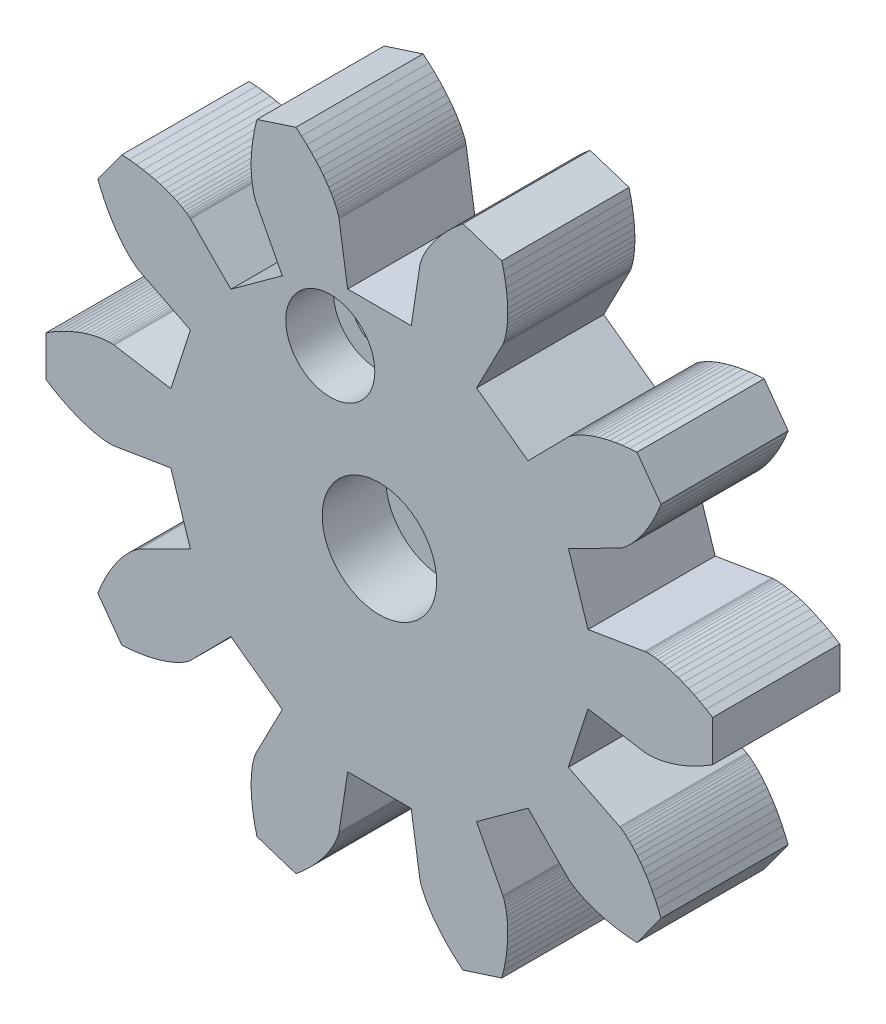
from build123d import *

# Parameters (mm, degrees)
BOSS_EXTRUDE1_DEPTH = 8
SKETCH2_R           = 3.6
CUT_EXTRUDE1_DEPTH  = 4
SKETCH3_R           = 1.6
CUT_EXTRUDE2_DEPTH  = 31.277782192
SKETCH7_R           = 2.8
CUT_EXTRUDE3_DEPTH  = 3
SKETCH8_R           = 1.55
CUT_EXTRUDE4_DEPTH  = 3


with BuildPart() as part:
    # Model → Boss-Extrude1 (new body)
    with BuildSketch(Plane.XY):
        Polygon((13.123211873, 2.161321388), (16.6790122, 2.746942299), (16.691613751, 2.748684274), (16.729575407, 2.75260353), (16.793046957, 2.756731367), (16.882063506, 2.75909222), (16.996545232, 2.757709602), (17.136297418, 2.75061204), (17.301010784, 2.735839019), (17.490262098, 2.711446898), (17.70351508, 2.675514791), (17.940121583, 2.626150408), (18.199323066, 2.561495829), (18.480252338, 2.479733213), (18.781935582, 2.379090411), (19.103294651, 2.257846486), (19.443149627, 2.114337127), (19.80022165, 1.946959926), (20.17313599, 1.754179531), (20.560425385, 1.534532644), (20.960533606, 1.286632864), (20.960533606, -1.286632864), (20.560425385, -1.534532644), (20.17313599, -1.754179531), (19.80022165, -1.946959926), (19.443149627, -2.114337127), (19.103294651, -2.257846486), (18.781935582, -2.379090411), (18.480252338, -2.479733213), (18.199323066, -2.561495829), (17.940121583, -2.626150408), (17.70351508, -2.675514791), (17.490262098, -2.711446898), (17.301010784, -2.735839019), (17.136297418, -2.75061204), (16.996545232, -2.757709602), (16.882063506, -2.75909222), (16.793046957, -2.756731367), (16.729575407, -2.75260353), (16.691613751, -2.748684274), (16.6790122, -2.746942299), (13.123211873, -2.161321388), (11.887294263, -5.965084669), (15.108216491, -7.581354391), (15.119435267, -7.58735211), (15.152450573, -7.606494667), (15.206226417, -7.640462818), (15.279629993, -7.690875462), (15.371434972, -7.759284694), (15.480325023, -7.847171016), (15.604897572, -7.955938728), (15.743667772, -8.086911501), (15.895072696, -8.241328143), (16.057475722, -8.420338581), (16.229171119, -8.625000043), (16.408388814, -8.856273472), (16.593299331, -9.115020171), (16.782018888, -9.401998688), (16.972614654, -9.717861942), (17.163110138, -10.06315461), (17.351490704, -10.438310776), (17.535709206, -10.843651835), (17.713691721, -11.279384681), (16.201164076, -13.361200387), (15.731757891, -13.32657781), (15.289328988, -13.276632879), (14.874321476, -13.213401945), (14.487062291, -13.138931277), (14.127761155, -13.055271044), (13.796510816, -12.964469318), (13.49328759, -12.868566094), (13.217952174, -12.769587357), (12.970250762, -12.6695392), (12.749816424, -12.570402012), (12.556170775, -12.47412474), (12.388725916, -12.382619249), (12.24678664, -12.297754786), (12.129552904, -12.221352561), (12.03612256, -12.155180452), (11.965494333, -12.100947867), (11.916571053, -12.060300736), (11.888163109, -12.034816689), (11.878992147, -12.026000396), (9.346508589, -9.462176135), (6.110834279, -11.813031127), (7.766595593, -15.013831385), (7.772146402, -15.025277872), (7.787604633, -15.060170436), (7.811144227, -15.119259895), (7.840897159, -15.203190121), (7.874959009, -15.312495965), (7.911394627, -15.447601459), (7.948243879, -15.608818294), (7.983527465, -15.79634457), (8.015252796, -16.010263839), (8.041419908, -16.250544429), (8.060027414, -16.517039052), (8.069078464, -16.809484705), (8.06658672, -17.127502856), (8.050582309, -17.470599926), (8.019117761, -17.838168046), (7.970273907, -18.22948612), (7.902165724, -18.643721152), (7.812948126, -19.079929875), (7.700821665, -19.537060651), (5.253500526, -20.332243492), (4.894093585, -20.028323206), (4.565517978, -19.727863724), (4.266936058, -19.432773529), (3.997409557, -19.144900255), (3.755903082, -18.866025795), (3.541287844, -18.597861592), (3.352345602, -18.342044113), (3.187772814, -18.100130537), (3.046184993, -17.873594641), (2.926121244, -17.663822917), (2.826048984, -17.472110911), (2.744368826, -17.299659795), (2.679419619, -17.14757319), (2.629483635, -17.01685423), (2.592791888, -16.908402891), (2.567529567, -16.823013578), (2.551841586, -16.761372975), (2.543838223, -16.724058178), (2.541600846, -16.711535091), (1.9997567, -13.148801205), (-1.9997567, -13.148801205), (-2.541600846, -16.711535091), (-2.543838223, -16.724058178), (-2.551841586, -16.761372975), (-2.567529567, -16.823013578), (-2.592791888, -16.908402891), (-2.629483635, -17.01685423), (-2.679419619, -17.14757319), (-2.744368826, -17.299659795), (-2.826048984, -17.472110911), (-2.926121244, -17.663822917), (-3.046184993, -17.873594641), (-3.187772814, -18.100130537), (-3.352345602, -18.342044113), (-3.541287844, -18.597861592), (-3.755903082, -18.866025795), (-3.997409557, -19.144900255), (-4.266936058, -19.432773529), (-4.565517978, -19.727863724), (-4.894093585, -20.028323206), (-5.253500526, -20.332243492), (-7.700821665, -19.537060651), (-7.812948126, -19.079929875), (-7.902165724, -18.643721152), (-7.970273907, -18.22948612), (-8.019117761, -17.838168046), (-8.050582309, -17.470599926), (-8.06658672, -17.127502856), (-8.069078464, -16.809484705), (-8.060027414, -16.517039052), (-8.041419908, -16.250544429), (-8.015252796, -16.010263839), (-7.983527465, -15.79634457), (-7.948243879, -15.608818294), (-7.911394627, -15.447601459), (-7.874959009, -15.312495965), (-7.840897159, -15.203190121), (-7.811144227, -15.119259895), (-7.787604633, -15.060170436), (-7.772146402, -15.025277872), (-7.766595593, -15.013831385), (-6.110834279, -11.813031127), (-9.346508589, -9.462176135), (-11.878992147, -12.026000396), (-11.888163109, -12.034816689), (-11.916571053, -12.060300736), (-11.965494333, -12.100947867), (-12.03612256, -12.155180452), (-12.129552904, -12.221352561), (-12.24678664, -12.297754786), (-12.388725916, -12.382619249), (-12.556170775, -12.47412474), (-12.749816424, -12.570402012), (-12.970250762, -12.6695392), (-13.217952174, -12.769587357), (-13.49328759, -12.868566094), (-13.796510816, -12.964469318), (-14.127761155, -13.055271044), (-14.487062291, -13.138931277), (-14.874321476, -13.213401945), (-15.289328988, -13.276632879), (-15.731757891, -13.32657781), (-16.201164076, -13.361200387), (-17.713691721, -11.279384681), (-17.535709206, -10.843651835), (-17.351490704, -10.438310776), (-17.163110138, -10.06315461), (-16.972614654, -9.717861942), (-16.782018888, -9.401998688), (-16.593299331, -9.115020171), (-16.408388814, -8.856273472), (-16.229171119, -8.625000043), (-16.057475722, -8.420338581), (-15.895072696, -8.241328143), (-15.743667772, -8.086911501), (-15.604897572, -7.955938728), (-15.480325023, -7.847171016), (-15.371434972, -7.759284694), (-15.279629993, -7.690875462), (-15.206226417, -7.640462818), (-15.152450573, -7.606494667), (-15.119435267, -7.58735211), (-15.108216491, -7.581354391), (-11.887294263, -5.965084669), (-13.123211873, -2.161321388), (-16.6790122, -2.746942299), (-16.691613751, -2.748684274), (-16.729575407, -2.75260353), (-16.793046957, -2.756731367), (-16.882063506, -2.75909222), (-16.996545232, -2.757709602), (-17.136297418, -2.75061204), (-17.301010784, -2.735839019), (-17.490262098, -2.711446898), (-17.70351508, -2.675514791), (-17.940121583, -2.626150408), (-18.199323066, -2.561495829), (-18.480252338, -2.479733213), (-18.781935582, -2.379090411), (-19.103294651, -2.257846486), (-19.443149627, -2.114337127), (-19.80022165, -1.946959926), (-20.17313599, -1.754179531), (-20.560425385, -1.534532644), (-20.960533606, -1.286632864), (-20.960533606, 1.286632864), (-20.560425385, 1.534532644), (-20.17313599, 1.754179531), (-19.80022165, 1.946959926), (-19.443149627, 2.114337127), (-19.103294651, 2.257846486), (-18.781935582, 2.379090411), (-18.480252338, 2.479733213), (-18.199323066, 2.561495829), (-17.940121583, 2.626150408), (-17.70351508, 2.675514791), (-17.490262098, 2.711446898), (-17.301010784, 2.735839019), (-17.136297418, 2.75061204), (-16.996545232, 2.757709602), (-16.882063506, 2.75909222), (-16.793046957, 2.756731367), (-16.729575407, 2.75260353), (-16.691613751, 2.748684274), (-16.6790122, 2.746942299), (-13.123211873, 2.161321388), (-11.887294263, 5.965084669), (-15.108216491, 7.581354391), (-15.119435267, 7.58735211), (-15.152450573, 7.606494667), (-15.206226417, 7.640462818), (-15.279629993, 7.690875462), (-15.371434972, 7.759284694), (-15.480325023, 7.847171016), (-15.604897572, 7.955938728), (-15.743667772, 8.086911501), (-15.895072696, 8.241328143), (-16.057475722, 8.420338581), (-16.229171119, 8.625000043), (-16.408388814, 8.856273472), (-16.593299331, 9.115020171), (-16.782018888, 9.401998688), (-16.972614654, 9.717861942), (-17.163110138, 10.06315461), (-17.351490704, 10.438310776), (-17.535709206, 10.843651835), (-17.713691721, 11.279384681), (-16.201164076, 13.361200387), (-15.731757891, 13.32657781), (-15.289328988, 13.276632879), (-14.874321476, 13.213401945), (-14.487062291, 13.138931277), (-14.127761155, 13.055271044), (-13.796510816, 12.964469318), (-13.49328759, 12.868566094), (-13.217952174, 12.769587357), (-12.970250762, 12.6695392), (-12.749816424, 12.570402012), (-12.556170775, 12.47412474), (-12.388725916, 12.382619249), (-12.24678664, 12.297754786), (-12.129552904, 12.221352561), (-12.03612256, 12.155180452), (-11.965494333, 12.100947867), (-11.916571053, 12.060300736), (-11.888163109, 12.034816689), (-11.878992147, 12.026000396), (-9.346508589, 9.462176135), (-6.110834279, 11.813031127), (-7.766595593, 15.013831385), (-7.772146402, 15.025277872), (-7.787604633, 15.060170436), (-7.811144227, 15.119259895), (-7.840897159, 15.203190121), (-7.874959009, 15.312495965), (-7.911394627, 15.447601459), (-7.948243879, 15.608818294), (-7.983527465, 15.79634457), (-8.015252796, 16.010263839), (-8.041419908, 16.250544429), (-8.060027414, 16.517039052), (-8.069078464, 16.809484705), (-8.06658672, 17.127502856), (-8.050582309, 17.470599926), (-8.019117761, 17.838168046), (-7.970273907, 18.22948612), (-7.902165724, 18.643721152), (-7.812948126, 19.079929875), (-7.700821665, 19.537060651), (-5.253500526, 20.332243492), (-4.894093585, 20.028323206), (-4.565517978, 19.727863724), (-4.266936058, 19.432773529), (-3.997409557, 19.144900255), (-3.755903082, 18.866025795), (-3.541287844, 18.597861592), (-3.352345602, 18.342044113), (-3.187772814, 18.100130537), (-3.046184993, 17.873594641), (-2.926121244, 17.663822917), (-2.826048984, 17.472110911), (-2.744368826, 17.299659795), (-2.679419619, 17.14757319), (-2.629483635, 17.01685423), (-2.592791888, 16.908402891), (-2.567529567, 16.823013578), (-2.551841586, 16.761372975), (-2.543838223, 16.724058178), (-2.541600846, 16.711535091), (-1.9997567, 13.148801205), (1.9997567, 13.148801205), (2.541600846, 16.711535091), (2.543838223, 16.724058178), (2.551841586, 16.761372975), (2.567529567, 16.823013578), (2.592791888, 16.908402891), (2.629483635, 17.01685423), (2.679419619, 17.14757319), (2.744368826, 17.299659795), (2.826048984, 17.472110911), (2.926121244, 17.663822917), (3.046184993, 17.873594641), (3.187772814, 18.100130537), (3.352345602, 18.342044113), (3.541287844, 18.597861592), (3.755903082, 18.866025795), (3.997409557, 19.144900255), (4.266936058, 19.432773529), (4.565517978, 19.727863724), (4.894093585, 20.028323206), (5.253500526, 20.332243492), (7.700821665, 19.537060651), (7.812948126, 19.079929875), (7.902165724, 18.643721152), (7.970273907, 18.22948612), (8.019117761, 17.838168046), (8.050582309, 17.470599926), (8.06658672, 17.127502856), (8.069078464, 16.809484705), (8.060027414, 16.517039052), (8.041419908, 16.250544429), (8.015252796, 16.010263839), (7.983527465, 15.79634457), (7.948243879, 15.608818294), (7.911394627, 15.447601459), (7.874959009, 15.312495965), (7.840897159, 15.203190121), (7.811144227, 15.119259895), (7.787604633, 15.060170436), (7.772146402, 15.025277872), (7.766595593, 15.013831385), (6.110834279, 11.813031127), (9.346508589, 9.462176135), (11.878992147, 12.026000396), (11.888163109, 12.034816689), (11.916571053, 12.060300736), (11.965494333, 12.100947867), (12.03612256, 12.155180452), (12.129552904, 12.221352561), (12.24678664, 12.297754786), (12.388725916, 12.382619249), (12.556170775, 12.47412474), (12.749816424, 12.570402012), (12.970250762, 12.6695392), (13.217952174, 12.769587357), (13.49328759, 12.868566094), (13.796510816, 12.964469318), (14.127761155, 13.055271044), (14.487062291, 13.138931277), (14.874321476, 13.213401945), (15.289328988, 13.276632879), (15.731757891, 13.32657781), (16.201164076, 13.361200387), (17.713691721, 11.279384681), (17.535709206, 10.843651835), (17.351490704, 10.438310776), (17.163110138, 10.06315461), (16.972614654, 9.717861942), (16.782018888, 9.401998688), (16.593299331, 9.115020171), (16.408388814, 8.856273472), (16.229171119, 8.625000043), (16.057475722, 8.420338581), (15.895072696, 8.241328143), (15.743667772, 8.086911501), (15.604897572, 7.955938728), (15.480325023, 7.847171016), (15.371434972, 7.759284694), (15.279629993, 7.690875462), (15.206226417, 7.640462818), (15.152450573, 7.606494667), (15.119435267, 7.58735211), (15.108216491, 7.581354391), (11.887294263, 5.965084669), align=None)
    extrude(amount=BOSS_EXTRUDE1_DEPTH)

    # Sketch2 → Cut-Extrude1 (cut)
    with BuildSketch(Plane.XY.offset(8)):
        Circle(SKETCH2_R)
    extrude(amount=-CUT_EXTRUDE1_DEPTH, mode=Mode.SUBTRACT)

    # Sketch3 → Cut-Extrude2 (cut, through all)
    with BuildSketch(Plane.XY.offset(8)):
        with Locations((-3.090169944, 9.510565163)):
            Circle(SKETCH3_R)
    extrude(amount=-CUT_EXTRUDE2_DEPTH, mode=Mode.SUBTRACT)

    # Sketch7 → Cut-Extrude3 (cut)
    with BuildSketch(Plane.XY.offset(8)):
        with Locations((-3.090169944, 9.510565163)):
            Circle(SKETCH7_R)
    extrude(amount=-CUT_EXTRUDE3_DEPTH, mode=Mode.SUBTRACT)

    # Sketch8 → Cut-Extrude4 (cut)
    with BuildSketch(Plane(origin=(0, 0, 0), x_dir=(-1, 0, 0), z_dir=(0, 0, -1))):
        Circle(SKETCH8_R)
    extrude(amount=-CUT_EXTRUDE4_DEPTH, mode=Mode.SUBTRACT)


solid = part.part
